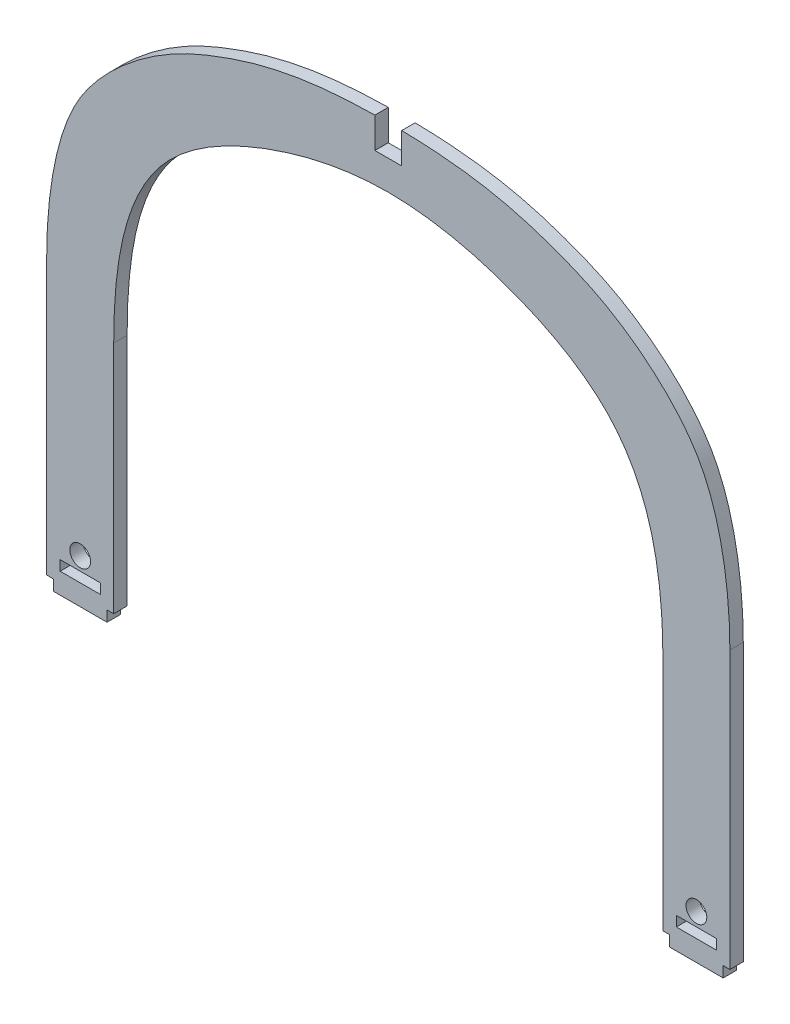
from build123d import *

# Parameters (mm, degrees)
EXTRUDE_591_DEPTH      = 2
SKETCH_661_W           = 4
SKETCH_661_H           = 6.6
CUT_EXTRUDE_1019_DEPTH = 133.151428436
SKETCH_1067_R          = 1.55
CUT_EXTRUDE_1436_DEPTH = 133.140941136
SKETCH_4_W             = 6
SKETCH_4_H             = 1.5
CUT_EXTRUDE_2007_DEPTH = 133.140941136


with BuildPart() as part:
    # 草图1 → Extrude 591 (new body)
    with BuildSketch(Plane.XY):
        with BuildLine():
            Line((0, 0), (1, 0))
            Line((1, 0), (1, -1.6))
            Line((1, -1.6), (9, -1.6))
            Line((9, -1.6), (9, 0))
            Line((9, 0), (10, 0))
            Line((10, 0), (10, 35))
            add(Edge.make_bspline(
                [(10, 35), (10, 45.958933229), (12.802105927, 61.850376918), (33.138971404, 72.605774334), (45.150309794, 75), (51, 75)],
                knots=[0, 0, 0, 0, 0.44110143, 0.721666216, 1, 1, 1, 1], degree=3))
            add(Edge.make_bspline(
                [(92, 35), (92, 45.958933229), (89.197894073, 61.850376918), (68.861028596, 72.605774334), (56.849690206, 75), (51, 75)],
                knots=[0, 0, 0, 0, 0.44110143, 0.721666216, 1, 1, 1, 1], degree=3))
            Line((92, 35), (92, 0))
            Line((92, 0), (93, 0))
            Line((93, 0), (93, -1.6))
            Line((93, -1.6), (101, -1.6))
            Line((101, -1.6), (101, 0))
            Line((101, 0), (102, 0))
            Line((102, 0), (102, 41.318702341))
            add(Edge.make_bspline(
                [(102, 41.318702341), (102, 48.39057612), (100.674869512, 58.830698863), (93.328102077, 69.833438872), (85.60235792, 76.079385067), (71.260445241, 82.051607308), (62.638712904, 84), (51, 84)],
                knots=[0, 0, 0, 0, 0.315306946, 0.38075993, 0.62411096, 0.689076855, 1, 1, 1, 1], degree=3))
            add(Edge.make_bspline(
                [(0, 41.318702341), (0, 48.39057612), (1.325130488, 58.830698863), (8.671897923, 69.833438872), (16.39764208, 76.079385067), (30.739554759, 82.051607308), (39.361287096, 84), (51, 84)],
                knots=[0, 0, 0, 0, 0.315306946, 0.38075993, 0.62411096, 0.689076855, 1, 1, 1, 1], degree=3))
            Line((0, 41.318702341), (0, 0))
        make_face()
    extrude(amount=EXTRUDE_591_DEPTH)

    # Sketch 661 → Cut-Extrude 1019 (cut, through all)
    with BuildSketch(Plane(origin=(0, 0, 0), x_dir=(-1, 0, 0), z_dir=(0, 0, -1))):
        with Locations((-51, 82.7)):
            Rectangle(SKETCH_661_W, SKETCH_661_H)
    extrude(amount=-CUT_EXTRUDE_1019_DEPTH, mode=Mode.SUBTRACT)

    # Sketch 1067 → Cut-Extrude 1436 (cut, through all)
    with BuildSketch(Plane(origin=(0, 0, 0), x_dir=(-1, 0, 0), z_dir=(0, 0, -1))):
        with Locations((-97, 5)):
            Circle(SKETCH_1067_R)
        with Locations(Location((-5, 5, 0), (0, 0, 180))):
            Circle(SKETCH_1067_R)
    extrude(amount=-CUT_EXTRUDE_1436_DEPTH, mode=Mode.SUBTRACT)

    # 草图4 → Cut-Extrude 2007 (cut, through all)
    with BuildSketch(Plane(origin=(0, 0, 0), x_dir=(-1, 0, 0), z_dir=(0, 0, -1))):
        with Locations((-97, 2.25)):
            Rectangle(SKETCH_4_W, SKETCH_4_H)
        with Locations((-5, 2.25)):
            Rectangle(SKETCH_4_W, SKETCH_4_H)
    extrude(amount=-CUT_EXTRUDE_2007_DEPTH, mode=Mode.SUBTRACT)


solid = part.part
